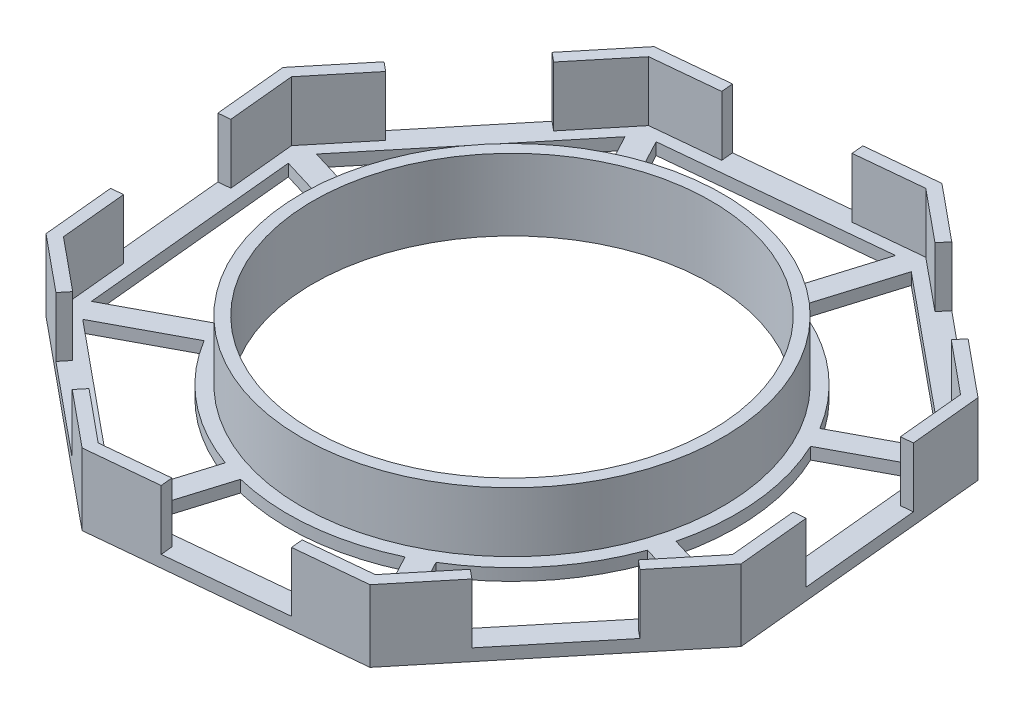
from build123d import *

# Parameters (mm, degrees)
SKETCH1_R           = 50
BOSS_EXTRUDE1_DEPTH = 18
SHELL1_T            = -3
CUT_EXTRUDE1_DEPTH  = 15
CUT_EXTRUDE2_DEPTH  = 119.097158392


with BuildPart() as part:
    # Sketch1 → Boss-Extrude1 (new body)
    with BuildSketch(Plane(origin=(0, 0, 0), x_dir=(1, 0, 0), z_dir=(0, 1, 0))):
        Polygon((-40.722412876, 76.418266738), (-82.830968907, 25.240780326), (-76.418266738, -40.722412876), (-25.240780326, -82.830968907), (40.722412876, -76.418266738), (82.830968907, -25.240780326), (76.418266738, 40.722412876), (25.240780326, 82.830968907), align=None)
        Circle(SKETCH1_R, mode=Mode.SUBTRACT)
    extrude(amount=BOSS_EXTRUDE1_DEPTH)

    # Shell1
    shell1_openings = [part.faces().sort_by_distance(p)[0] for p in [
        (-59.967550003, 18, -49.340972299),
    ]]
    offset(amount=SHELL1_T, openings=shell1_openings, kind=Kind.INTERSECTION)

    # Sketch3 → Cut-Extrude1 (cut)
    with BuildSketch(Plane(origin=(0, 18, 0), x_dir=(1, 0, 0), z_dir=(0, 1, 0))):
        Polygon((7.118415409, 81.069178382), (7.408696019, 78.083255213), (-22.450535664, 75.18044911), (-22.740816275, 78.166372279), align=None)
        Polygon((60.451938453, 49.974460064), (37.285679369, 69.035531388), (39.191786502, 71.352157297), (62.358045586, 52.291085972), align=None)
        Polygon((78.083255213, -7.408696019), (75.18044911, 22.450535664), (78.166372279, 22.740816275), (81.069178382, -7.118415409), align=None)
        Polygon((49.974460064, -60.451938453), (69.035531388, -37.285679369), (71.352157297, -39.191786502), (52.291085972, -62.358045586), align=None)
        Polygon((-7.408696019, -78.083255213), (22.450535664, -75.18044911), (22.740816275, -78.166372279), (-7.118415409, -81.069178382), align=None)
        Polygon((-60.451938453, -49.974460064), (-37.285679369, -69.035531388), (-39.191786502, -71.352157297), (-62.358045586, -52.291085972), align=None)
        Polygon((-78.083255213, 7.408696019), (-75.18044911, -22.450535664), (-78.166372279, -22.740816275), (-81.069178382, 7.118415409), align=None)
        Polygon((-49.974460064, 60.451938453), (-69.035531388, 37.285679369), (-71.352157297, 39.191786502), (-52.291085972, 62.358045586), align=None)
    extrude(amount=-CUT_EXTRUDE1_DEPTH, mode=Mode.SUBTRACT)

    # Sketch5 → Cut-Extrude2 (cut, through all)
    with BuildSketch(Plane(origin=(0, 3, 0), x_dir=(1, 0, 0), z_dir=(0, 1, 0))):
        with BuildLine():
            Line((-34.746953293, 70.970892834), (-24.087191321, 50.967153462))
            ThreePointArc((-24.087191321, 50.967153462), (-5.614880768, 56.092037151), (13.506743194, 54.730351781))
            Line((13.506743194, 54.730351781), (20.079875719, 76.300958107))
            Line((20.079875719, 76.300958107), (-34.746953293, 70.970892834))
        make_face()
        with BuildLine():
            Line((25.614193291, 74.753805889), (68.151541175, 39.754308602))
            Line((68.151541175, 39.754308602), (48.250912585, 29.149493176))
            ThreePointArc((48.250912585, 29.149493176), (35.692739573, 43.633380106), (19.007003508, 53.071436154))
            Line((19.007003508, 53.071436154), (25.614193291, 74.753805889))
        make_face()
        with BuildLine():
            Line((70.970892834, 34.746953293), (76.300958107, -20.079875719))
            Line((76.300958107, -20.079875719), (54.730351781, -13.506743194))
            ThreePointArc((54.730351781, -13.506743194), (56.092037151, 5.614880768), (50.967153462, 24.087191321))
            Line((50.967153462, 24.087191321), (70.970892834, 34.746953293))
        make_face()
        with BuildLine():
            Line((74.753805889, -25.614193291), (39.754308602, -68.151541175))
            Line((39.754308602, -68.151541175), (29.149493176, -48.250912585))
            ThreePointArc((29.149493176, -48.250912585), (43.633380106, -35.692739573), (53.071436154, -19.007003508))
            Line((53.071436154, -19.007003508), (74.753805889, -25.614193291))
        make_face()
        with BuildLine():
            Line((34.746953293, -70.970892834), (-20.079875719, -76.300958107))
            Line((-20.079875719, -76.300958107), (-13.506743194, -54.730351781))
            ThreePointArc((-13.506743194, -54.730351781), (5.614880768, -56.092037151), (24.087191321, -50.967153462))
            Line((24.087191321, -50.967153462), (34.746953293, -70.970892834))
        make_face()
        with BuildLine():
            Line((-25.614193291, -74.753805889), (-68.151541175, -39.754308602))
            Line((-68.151541175, -39.754308602), (-48.250912585, -29.149493176))
            ThreePointArc((-48.250912585, -29.149493176), (-35.692739573, -43.633380106), (-19.007003508, -53.071436154))
            Line((-19.007003508, -53.071436154), (-25.614193291, -74.753805889))
        make_face()
        with BuildLine():
            Line((-70.970892834, -34.746953293), (-76.300958107, 20.079875719))
            Line((-76.300958107, 20.079875719), (-54.730351781, 13.506743194))
            ThreePointArc((-54.730351781, 13.506743194), (-56.092037151, -5.614880768), (-50.967153462, -24.087191321))
            Line((-50.967153462, -24.087191321), (-70.970892834, -34.746953293))
        make_face()
        with BuildLine():
            Line((-74.753805889, 25.614193291), (-39.754308602, 68.151541175))
            Line((-39.754308602, 68.151541175), (-29.149493176, 48.250912585))
            ThreePointArc((-29.149493176, 48.250912585), (-43.633380106, 35.692739573), (-53.071436154, 19.007003508))
            Line((-53.071436154, 19.007003508), (-74.753805889, 25.614193291))
        make_face()
    extrude(amount=-CUT_EXTRUDE2_DEPTH, mode=Mode.SUBTRACT)


solid = part.part
